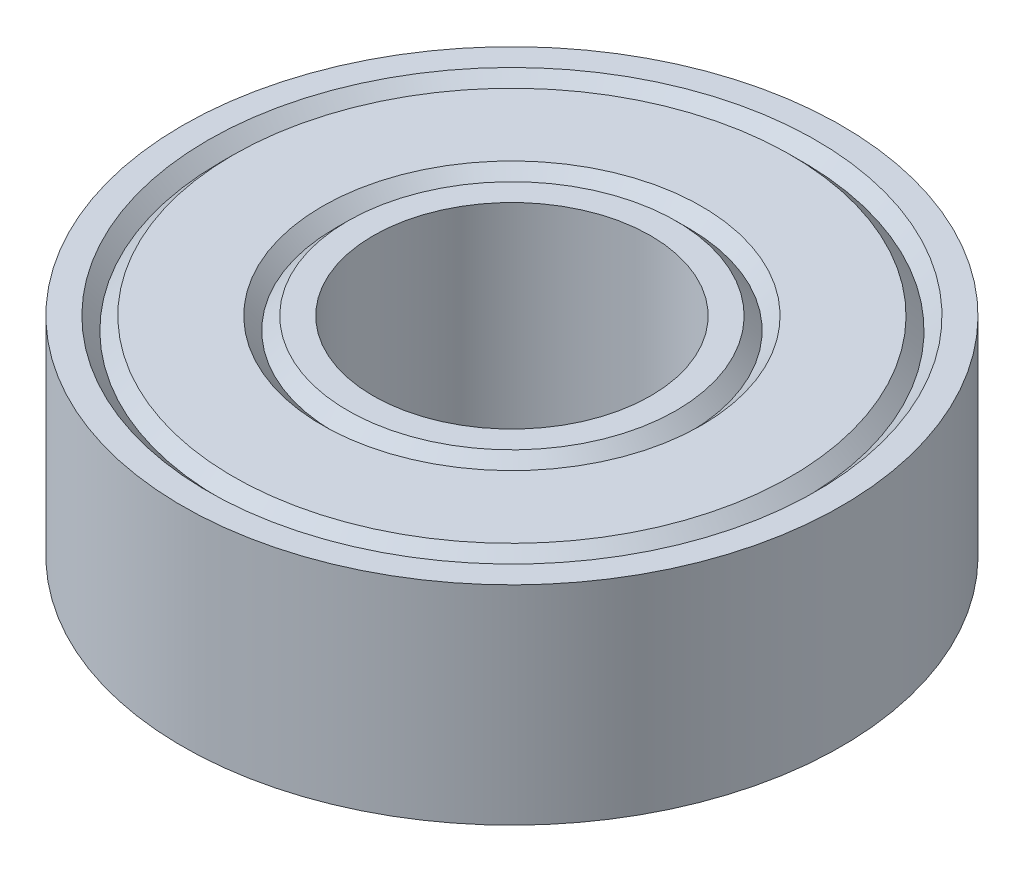
from build123d import *


with BuildPart() as part:
    # Sketch1 → Revolve1 (revolve)
    with BuildSketch(Plane.XY):
        Polygon((-4, 3), (-4.733333333, 3), (-5.1, 2.633333333), (-5.466666667, 3), (-8.033333333, 3), (-8.4, 2.633333333), (-8.766666667, 3), (-9.5, 3), (-9.5, -3), (-8.766666667, -3), (-8.4, -2.633333333), (-8.033333333, -3), (-5.466666667, -3), (-5.1, -2.633333333), (-4.733333333, -3), (-4, -3), align=None)
    revolve(axis=Axis((0, 3, 0), (0, -1, 0)))


solid = part.part
